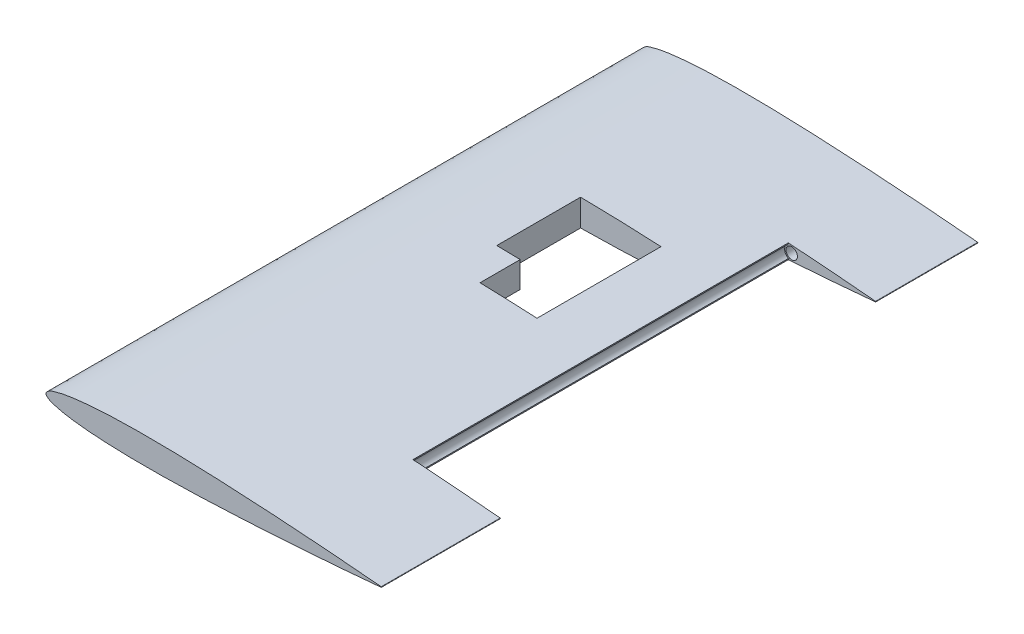
from build123d import *

# Parameters (mm, degrees)
FOAMBASSA_DEPTH                = 30.5
FOAMMEDIA_DEPTH                = 112
SCHIZZO4_W                     = 1
SCHIZZO4_H                     = 4.352344546
SMUSSOPARTEMOBILE_DEPTH        = 112
FOAMALTA_DEPTH                 = 35.5
FOROPERNORUDDEVATOR_DEPTH      = 142.5
FOROPERNORUDDEVATOR_DEPTH_BACK = 179.294882462
SCHIZZO5_R                     = 1.7
FOROSERVOMOTORE_DEPTH          = 205.687164063
SCHIZZO14_W                    = 40
SCHIZZO14_H                    = 4
TAGLIOSPINA_DEPTH              = 18


with BuildPart() as part:
    # Schizzo1 → FoamBassa (new body)
    with BuildSketch(Plane.XY):
        with BuildLine():
            ThreePointArc((100, 0.084), (100.084, 0), (100, -0.084))
            add(Edge.make_bspline(
                [(100, 0.084), (98.333488815, 0.23674648), (95.001194725, 0.542172689), (88.335559621, 1.11089898), (80.003293356, 1.763610995), (70.002998933, 2.457861693), (60.003104625, 3.061747723), (50.003008601, 3.552139212), (40.002598558, 3.902946494), (31.666961486, 4.025260151), (24.9991546, 3.976933791), (19.997775587, 3.844976398), (14.993363131, 3.592486959), (10.827184065, 3.237651579), (7.489054388, 2.814021367), (4.99359465, 2.403673059), (2.84962634, 1.867925494), (1.165413503, 1.320987252), (-0.664613784, 0), (1.165413503, -1.320987252), (2.84962634, -1.867925494), (4.99359465, -2.403673059), (7.489054388, -2.814021367), (10.827184065, -3.237651579), (14.993363131, -3.592486959), (19.997775587, -3.844976398), (24.9991546, -3.976933791), (31.666961486, -4.025260151), (40.002598558, -3.902946494), (50.003008601, -3.552139212), (60.003104625, -3.061747723), (70.002998933, -2.457861693), (80.003293356, -1.763610995), (88.335559621, -1.11089898), (95.001194725, -0.542172689), (98.333488815, -0.23674648), (100, -0.084)],
                knots=[0, 0, 0, 0, 0.024876293, 0.049741715, 0.099443402, 0.149112224, 0.198750974, 0.248359097, 0.29793737, 0.347491327, 0.37226694, 0.397050924, 0.421859475, 0.446731346, 0.459220451, 0.471790602, 0.484560454, 0.491195112, 0.5, 0.508804888, 0.515439546, 0.528209398, 0.540779549, 0.553268654, 0.578140525, 0.602949076, 0.62773306, 0.652508673, 0.70206263, 0.751640903, 0.801249026, 0.850887776, 0.900556598, 0.950258285, 0.975123707, 1, 1, 1, 1], degree=3))
        make_face()
    extrude(amount=FOAMBASSA_DEPTH)

    # Schizzo2 → FoamMedia (add)
    with BuildSketch(Plane.XY.offset(30.5)):
        with BuildLine():
            ThreePointArc((75, 2.107216055), (72.892783944, 0), (75, -2.107216055))
            add(Edge.make_bspline(
                [(75, 2.107216055), (73.333587352, 2.222873526), (68.33507528, 2.558586337), (60.003104625, 3.061747723), (50.003008601, 3.552139212), (40.002598558, 3.902946494), (31.666961486, 4.025260151), (24.9991546, 3.976933791), (19.997775587, 3.844976398), (14.993363131, 3.592486959), (10.827184065, 3.237651579), (7.489054388, 2.814021367), (4.99359465, 2.403673059), (2.84962634, 1.867925494), (1.165413503, 1.320987252), (-0.664613784, 0), (1.165413503, -1.320987252), (2.84962634, -1.867925494), (4.99359465, -2.403673059), (7.489054388, -2.814021367), (10.827184065, -3.237651579), (14.993363131, -3.592486959), (19.997775587, -3.844976398), (24.9991546, -3.976933791), (31.666961486, -4.025260151), (40.002598558, -3.902946494), (50.003008601, -3.552139212), (60.003104625, -3.061747723), (68.33507528, -2.558586337), (73.333587352, -2.222873526), (75, -2.107216055)],
                knots=[0.124281666, 0.124281666, 0.124281666, 0.124281666, 0.149112224, 0.198750974, 0.248359097, 0.29793737, 0.347491327, 0.37226694, 0.397050924, 0.421859475, 0.446731346, 0.459220451, 0.471790602, 0.484560454, 0.491195112, 0.5, 0.508804888, 0.515439546, 0.528209398, 0.540779549, 0.553268654, 0.578140525, 0.602949076, 0.62773306, 0.652508673, 0.70206263, 0.751640903, 0.801249026, 0.850887776, 0.875718334, 0.875718334, 0.875718334, 0.875718334], degree=3))
        make_face()
    extrude(amount=FOAMMEDIA_DEPTH)

    # Schizzo4 → SmussoParteMobile (cut)
    with BuildSketch(Plane.XY.offset(142.5)):
        with Locations((74.5, 0)):
            Rectangle(SCHIZZO4_W, SCHIZZO4_H)
    extrude(amount=-SMUSSOPARTEMOBILE_DEPTH, mode=Mode.SUBTRACT)

    # Schizzo6 → FoamAlta (add)
    with BuildSketch(Plane.XY.offset(142.5)):
        with BuildLine():
            ThreePointArc((100, 0.084), (100.084, 0), (100, -0.084))
            add(Edge.make_bspline(
                [(100, 0.084), (98.333488815, 0.23674648), (95.001194725, 0.542172689), (88.335559621, 1.11089898), (80.003293356, 1.763610995), (70.002998933, 2.457861693), (60.003104625, 3.061747723), (50.003008601, 3.552139212), (40.002598558, 3.902946494), (31.666961486, 4.025260151), (24.9991546, 3.976933791), (19.997775587, 3.844976398), (14.993363131, 3.592486959), (10.827184065, 3.237651579), (7.489054388, 2.814021367), (4.99359465, 2.403673059), (2.84962634, 1.867925494), (1.165413503, 1.320987252), (-0.664613784, 0), (1.165413503, -1.320987252), (2.84962634, -1.867925494), (4.99359465, -2.403673059), (7.489054388, -2.814021367), (10.827184065, -3.237651579), (14.993363131, -3.592486959), (19.997775587, -3.844976398), (24.9991546, -3.976933791), (31.666961486, -4.025260151), (40.002598558, -3.902946494), (50.003008601, -3.552139212), (60.003104625, -3.061747723), (70.002998933, -2.457861693), (80.003293356, -1.763610995), (88.335559621, -1.11089898), (95.001194725, -0.542172689), (98.333488815, -0.23674648), (100, -0.084)],
                knots=[0, 0, 0, 0, 0.024876293, 0.049741715, 0.099443402, 0.149112224, 0.198750974, 0.248359097, 0.29793737, 0.347491327, 0.37226694, 0.397050924, 0.421859475, 0.446731346, 0.459220451, 0.471790602, 0.484560454, 0.491195112, 0.5, 0.508804888, 0.515439546, 0.528209398, 0.540779549, 0.553268654, 0.578140525, 0.602949076, 0.62773306, 0.652508673, 0.70206263, 0.751640903, 0.801249026, 0.850887776, 0.900556598, 0.950258285, 0.975123707, 1, 1, 1, 1], degree=3))
        make_face()
    extrude(amount=FOAMALTA_DEPTH)

    # Schizzo5 → ForoPernoRuddevator (cut, two sides: drawn at the far end of the back side and taken through both)
    with BuildSketch(Plane.XY.offset(30.5).offset(-FOROPERNORUDDEVATOR_DEPTH_BACK)):
        with Locations((75, 0)):
            Circle(SCHIZZO5_R)
    extrude(amount=FOROPERNORUDDEVATOR_DEPTH + FOROPERNORUDDEVATOR_DEPTH_BACK, mode=Mode.SUBTRACT)

    # Schizzo12 → ForoServomotore (cut, through all)
    with BuildSketch(Plane(origin=(0, -10, 0), x_dir=(1, 0, 0), z_dir=(0, 1, 0))):
        Polygon((57, -76.5), (57, -88.5), (40, -88.5), (40, -76.5), (33, -76.5), (33, -51.5), (57, -51.5), align=None)
    extrude(amount=FOROSERVOMOTORE_DEPTH, mode=Mode.SUBTRACT)

    # Schizzo14 → TaglioSpina (cut)
    with BuildSketch(Plane(origin=(0, 0, 0), x_dir=(-1, 0, 0), z_dir=(0, 0, -1))):
        with Locations((-35, 0)):
            Rectangle(SCHIZZO14_W, SCHIZZO14_H)
    extrude(amount=-TAGLIOSPINA_DEPTH, mode=Mode.SUBTRACT)


solid = part.part
